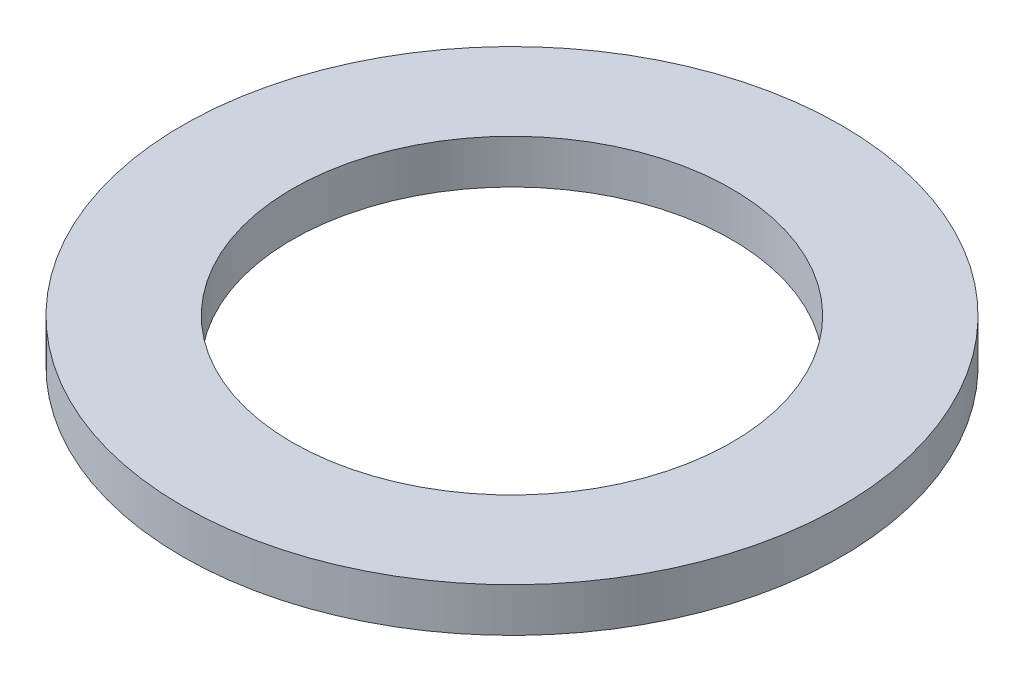
from build123d import *

# Parameters (mm, degrees)
BOSS_EXTRUDE1_DEPTH      = 0.3175
BOSS_EXTRUDE1_DEPTH_BACK = 0.3175
SKETCH3_R                = 4.7625
SKETCH3_R_2              = 3.175


with BuildPart() as part:
    # Sketch3 → Boss-Extrude1 (new, two sides: drawn at the far end of the back side and taken through both)
    with BuildSketch(Plane(origin=(0, 0, 0), x_dir=(1, 0, 0), z_dir=(0, 1, 0)).offset(-BOSS_EXTRUDE1_DEPTH_BACK)):
        with Locations(Location((0, 0, 0), (0, 0, 270))):
            Circle(SKETCH3_R)
        with Locations(Location((0, 0, 0), (0, 0, 270))):
            Circle(SKETCH3_R_2, mode=Mode.SUBTRACT)
    extrude(amount=BOSS_EXTRUDE1_DEPTH + BOSS_EXTRUDE1_DEPTH_BACK)


solid = part.part
